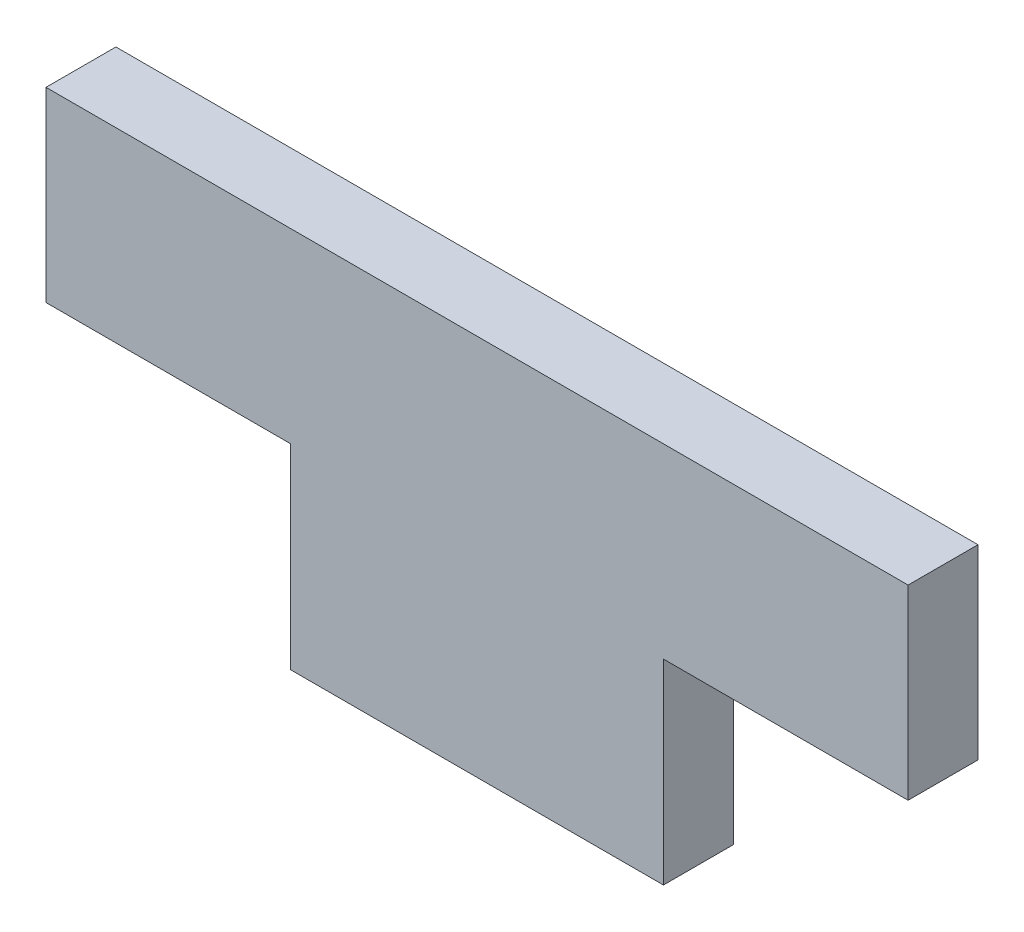
from build123d import *

# Parameters (mm, degrees)
SKETCH1_W           = 18.5
SKETCH1_H           = 4
BOSS_EXTRUDE1_DEPTH = 0.75
SKETCH2_W           = 8
SKETCH2_H           = 4.2
BOSS_EXTRUDE2_DEPTH = 0.75


with BuildPart() as part:
    # Sketch1 → Boss-Extrude1 (new body)
    with BuildSketch(Plane.XY):
        Rectangle(SKETCH1_W, SKETCH1_H)
    boss_extrude1 = extrude(amount=BOSS_EXTRUDE1_DEPTH)

    # Sketch2 → Boss-Extrude2 (add)
    with BuildSketch(Plane.XY):
        with Locations((0, -4.1)):
            Rectangle(SKETCH2_W, SKETCH2_H)
    boss_extrude2 = extrude(amount=BOSS_EXTRUDE2_DEPTH)

    # Mirror1: Boss-Extrude1, Boss-Extrude2 across plane
    add(boss_extrude1.mirror(Plane.XY))
    add(boss_extrude2.mirror(Plane.XY))


solid = part.part
